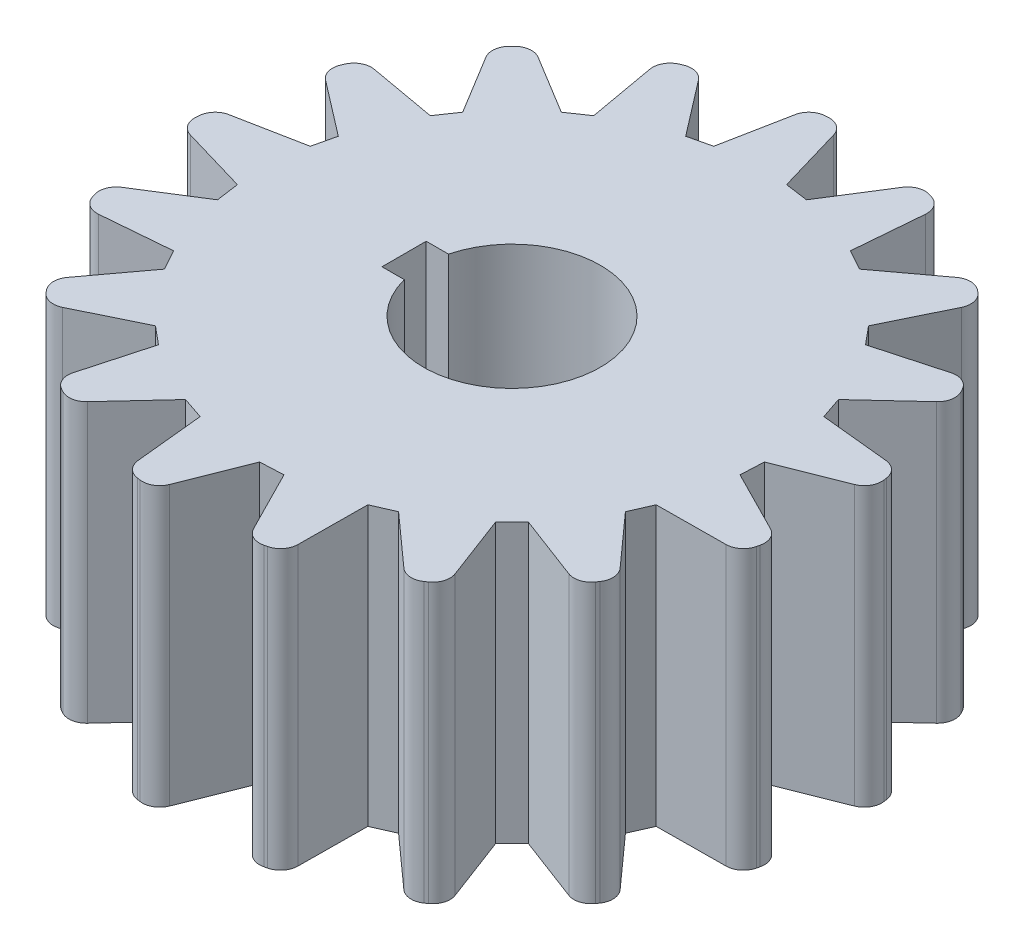
from build123d import *

# Parameters (mm, degrees)
ENL_V_MAT_EXTRU_3_DEPTH            = 79.182478856
CONG_1_R                           = 2.5
R_P_TITION_CIRCULAIRE1_COUNT       = 17
CONG_1_OF_R_P_TITION_CIRCULAIRE1_R = 2.5
ENL_V_MAT_EXTRU_4_DEPTH            = 79.135714235


with BuildPart() as part:
    # Esquisse1 → Révolution1 (revolve)
    with BuildSketch(Plane.XY, mode=Mode.PRIVATE) as r_volution1_sk:
        Polygon((-47.5, 40), (-47.5, 0), (-40, 0), (0, 0), (0, 40), (-40, 40), align=None)
    revolve(r_volution1_sk.sketch.rotate(Axis((0, 40, 0), (0, -1, 0)), 270), axis=Axis((0, 40, 0), (0, -1, 0)))

    # Esquisse5 → Enlèv. mat.-Extru.3 (cut, through all)
    with BuildSketch(Plane(origin=(0, 40, 0), x_dir=(1, 0, 0), z_dir=(0, 1, 0))):
        with BuildLine():
            ThreePointArc((-4.382747075, 47.297373374), (-10.875151123, 46.238307582), (-17.158979144, 44.292430897))
            Line((-17.158979144, 44.292430897), (-9.920283391, 34.866179565))
            Line((-9.920283391, 34.866179565), (-6.660920021, 35.632774863))
            Line((-6.660920021, 35.632774863), (-4.382747075, 47.297373374))
        make_face()
    enl_v_mat_extru_3 = extrude(amount=-ENL_V_MAT_EXTRU_3_DEPTH, mode=Mode.SUBTRACT)

    # Congé1
    cong_1_edges = [part.edges().sort_by_distance(p)[0] for p in [
        (-17.158979144, 20, -44.292430897),
        (-4.382747075, 20, -47.297373374),
    ]]
    fillet(cong_1_edges, radius=CONG_1_R)

    # Répétition circulaire1: Enlèv. mat.-Extru.3 ×17 about axis
    r_p_tition_circulaire1_axis = Axis((0, 0, 0), (0, 1, 0))
    for i in range(1, R_P_TITION_CIRCULAIRE1_COUNT):
        add(enl_v_mat_extru_3.rotate(r_p_tition_circulaire1_axis, i * 360 / R_P_TITION_CIRCULAIRE1_COUNT), mode=Mode.SUBTRACT)

    # Congé1 of Répétition circulaire1
    cong_1_of_r_p_tition_circulaire1_edges = [part.edges().sort_by_distance(p)[0] for p in [
        (-32.000543073, 20, -35.102923568),
        (-21.1725719, 20, -42.520256339),
        (-42.520256339, 20, -21.172571899),
        (-35.102923568, 20, -32.000543073),
        (-47.297373374, 20, -4.382747075),
        (-44.292430897, 20, -17.158979144),
        (-45.686718051, 20, 12.998992028),
        (-47.5, 20, 0),
        (-37.905818296, 20, 28.625145228),
        (-44.292430897, 20, 17.158979144),
        (-25.005527737, 20, 40.385313947),
        (-35.102923568, 20, 32.000543073),
        (-8.728102096, 20, 46.691222235),
        (-21.172571899, 20, 42.52025634),
        (8.728102096, 20, 46.691222235),
        (-4.382747074, 20, 47.297373374),
        (25.005527737, 20, 40.385313947),
        (12.998992029, 20, 45.686718051),
        (37.905818296, 20, 28.625145228),
        (28.625145228, 20, 37.905818296),
        (45.686718051, 20, 12.998992028),
        (40.385313947, 20, 25.005527736),
        (47.297373374, 20, -4.382747075),
        (46.691222235, 20, 8.728102096),
        (42.520256339, 20, -21.172571899),
        (46.691222235, 20, -8.728102097),
        (32.000543073, 20, -35.102923568),
        (40.385313947, 20, -25.005527737),
        (17.158979144, 20, -44.292430897),
        (28.625145228, 20, -37.905818296),
        (0, 20, -47.5),
        (12.998992028, 20, -45.686718051),
    ]]
    fillet(cong_1_of_r_p_tition_circulaire1_edges, radius=CONG_1_OF_R_P_TITION_CIRCULAIRE1_R)

    # Esquisse6 → Enlèv. mat.-Extru.4 (cut, through all)
    with BuildSketch(Plane(origin=(0, 40, 0), x_dir=(1, 0, 0), z_dir=(0, 1, 0))):
        with BuildLine():
            Line((-12.296722124, 3.175), (-15.496722124, 3.175))
            Line((-15.496722124, 3.175), (-15.496722124, -3.175))
            Line((-15.496722124, -3.175), (-12.296722124, -3.175))
            ThreePointArc((-12.296722124, -3.175), (12.7, 0), (-12.296722124, 3.175))
        make_face()
    extrude(amount=-ENL_V_MAT_EXTRU_4_DEPTH, mode=Mode.SUBTRACT)


solid = part.part
